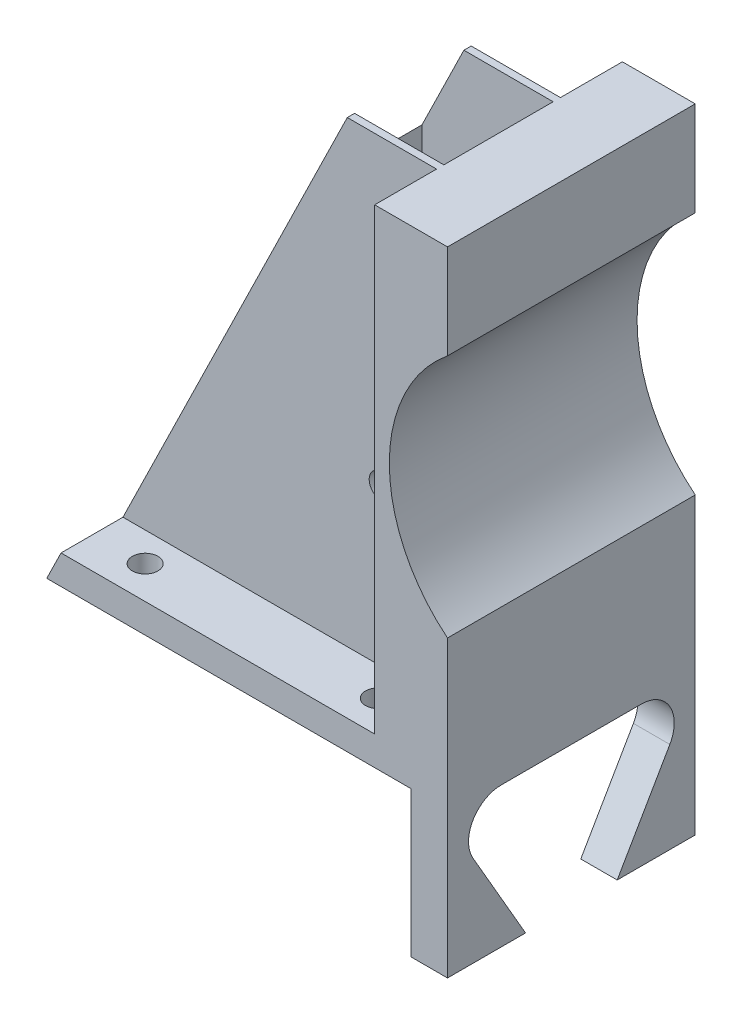
from build123d import *

# Parameters (mm, degrees)
BOSS_EXTRUDE2_DEPTH = 34
SKETCH5_W           = 50
SKETCH5_H           = 20
CUT_EXTRUDE1_DEPTH  = 8.5
SKETCH6_W           = 50
SKETCH6_H           = 20
CUT_EXTRUDE2_DEPTH  = 8.5
SKETCH7_W           = 52.006330756
SKETCH7_H           = 21.627895193
CUT_EXTRUDE3_DEPTH  = 87.390073596
CUT_EXTRUDE4_DEPTH  = 101.468874862
SKETCH10_R          = 1.75
CUT_EXTRUDE5_DEPTH  = 10
SKETCH14_W          = 15
SKETCH14_H          = 37
CUT_EXTRUDE8_DEPTH  = 18
SKETCH15_W          = 18
SKETCH15_H          = 15
CUT_EXTRUDE9_DEPTH  = 9
SKETCH16_W          = 13
SKETCH16_H          = 9
CUT_EXTRUDE10_DEPTH = 96.362439231
SKETCH17_R          = 1.75
CUT_EXTRUDE11_DEPTH = 87.390073596


with BuildPart() as part:
    # Sketch4 → Boss-Extrude2 (new body)
    with BuildSketch(Plane.XY):
        with BuildLine():
            Line((-25, -10), (30, -10))
            Line((30, -10), (30, 30.414))
            ThreePointArc((30, 30.414), (22.015013929, 47.178), (30, 63.942))
            Line((30, 63.942), (30, 76.896))
            Line((30, 76.896), (7.747226033, 76.896))
            Line((7.747226033, 76.896), (-25, 10))
            Line((-25, 10), (-25, -10))
        make_face()
    extrude(amount=BOSS_EXTRUDE2_DEPTH)

    # Sketch5 → Cut-Extrude1 (cut)
    with BuildSketch(Plane.XY.offset(34)):
        Polygon((-23.041902294, 14), (7.747226033, 76.896), (20, 76.896), (20, 14), align=None)
        Rectangle(SKETCH5_W, SKETCH5_H)
    extrude(amount=-CUT_EXTRUDE1_DEPTH, mode=Mode.SUBTRACT)

    # Sketch6 → Cut-Extrude2 (cut)
    with BuildSketch(Plane(origin=(0, 0, 0), x_dir=(-1, 0, 0), z_dir=(0, 0, -1))):
        Polygon((23.041902294, 14), (-20, 14), (-20, 76.896), (-7.747226033, 76.896), align=None)
        Rectangle(SKETCH6_W, SKETCH6_H)
    extrude(amount=-CUT_EXTRUDE2_DEPTH, mode=Mode.SUBTRACT)

    # Sketch7 → Cut-Extrude3 (cut, through all)
    with BuildSketch(Plane(origin=(0, 0, 8.5), x_dir=(-1, 0, 0), z_dir=(0, 0, -1))):
        with Locations((1.003165378, -0.813947597)):
            Rectangle(SKETCH7_W, SKETCH7_H)
    extrude(amount=-CUT_EXTRUDE3_DEPTH, mode=Mode.SUBTRACT)

    # Sketch9 → Cut-Extrude4 (cut, through all)
    with BuildSketch(Plane(origin=(30, 0, 0), x_dir=(0, 0, -1), z_dir=(1, 0, 0))):
        with BuildLine():
            Line((-26.615, 9.257), (-7.385, 9.257))
            ThreePointArc((-7.385, 9.257), (-3.487778361, 7.006814103), (-3.488100353, 2.506628222))
            Line((-3.488100353, 2.506628222), (-13.103100353, -14.143371778))
            ThreePointArc((-13.103100353, -14.143371778), (-17, -16.393), (-20.896899647, -14.143371778))
            Line((-20.896899647, -14.143371778), (-30.511899647, 2.506628222))
            ThreePointArc((-30.511899647, 2.506628222), (-30.512221639, 7.006814103), (-26.615, 9.257))
        make_face()
    extrude(amount=-CUT_EXTRUDE4_DEPTH, mode=Mode.SUBTRACT)

    # Sketch10 → Cut-Extrude5 (cut)
    with BuildSketch(Plane.XZ.offset(-10)):
        with Locations(Location((16, 29.5, 0), (0, 0, 270))):
            Circle(SKETCH10_R)
        with Locations(Location((16, 4.5, 0), (0, 0, 270))):
            Circle(SKETCH10_R)
        with Locations(Location((-16, 29.5, 0), (0, 0, 270))):
            Circle(SKETCH10_R)
        with Locations(Location((-16, 4.5, 0), (0, 0, 270))):
            Circle(SKETCH10_R)
    extrude(amount=-CUT_EXTRUDE5_DEPTH, mode=Mode.SUBTRACT)

    # Sketch14 → Cut-Extrude8 (cut)
    with BuildSketch(Plane.ZY.offset(-20)):
        with Locations((17, 58.396)):
            Rectangle(SKETCH14_W, SKETCH14_H)
    extrude(amount=CUT_EXTRUDE8_DEPTH, mode=Mode.SUBTRACT)

    # Sketch15 → Cut-Extrude9 (cut)
    with BuildSketch(Plane(origin=(0, 39.896, 0), x_dir=(1, 0, 0), z_dir=(0, 1, 0))):
        with Locations((11, -17)):
            Rectangle(SKETCH15_W, SKETCH15_H)
    extrude(amount=-CUT_EXTRUDE9_DEPTH, mode=Mode.SUBTRACT)

    # Sketch16 → Cut-Extrude10 (cut, through all)
    with BuildSketch(Plane.ZY.offset(-20)):
        with Locations((17, 35.396)):
            Rectangle(SKETCH16_W, SKETCH16_H)
    extrude(amount=CUT_EXTRUDE10_DEPTH, mode=Mode.SUBTRACT)

    # Sketch17 → Cut-Extrude11 (cut, through all)
    with BuildSketch(Plane.XY.offset(25.5)):
        with Locations((12.5, 35.396)):
            Circle(SKETCH17_R)
    extrude(amount=-CUT_EXTRUDE11_DEPTH, mode=Mode.SUBTRACT)


solid = part.part
